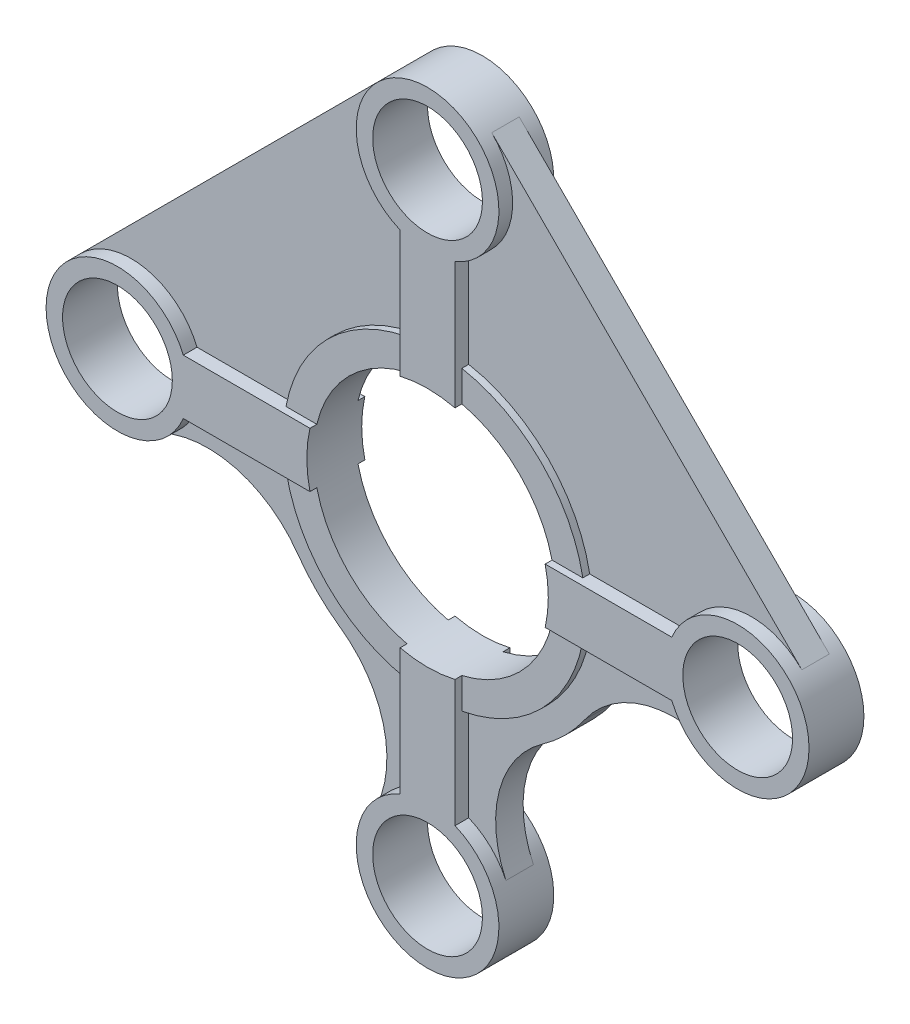
from build123d import *

# Parameters (mm, degrees)
SKETCH1_R             = 20
BOSS_EXTRUDE1_DEPTH   = 10
BOSS_EXTRUDE1_2_DEPTH = 10
BOSS_EXTRUDE1_3_DEPTH = 10
BOSS_EXTRUDE1_4_DEPTH = 10
BOSS_EXTRUDE2_DEPTH   = 7.5
BOSS_EXTRUDE3_DEPTH   = 5


with BuildPart() as part:
    # Sketch1 → Boss-Extrude1 (new, symmetric)
    with BuildSketch(Plane.XY):
        with BuildLine():
            ThreePointArc((-42.848570571, -10), (-44, 0), (-42.848570571, 10))
            Line((-42.848570571, 10), (-89, 10))
            ThreePointArc((-89, 10), (-139, 0), (-89, -10))
            Line((-89, -10), (-42.848570571, -10))
        make_face()
        with Locations((-113, 0)):
            Circle(SKETCH1_R, mode=Mode.SUBTRACT)
    extrude(amount=BOSS_EXTRUDE1_DEPTH, both=True)



with BuildPart() as body_2:
    # Sketch1 → Boss-Extrude1 2 (new, symmetric)
    with BuildSketch(Plane.XY):
        with BuildLine():
            ThreePointArc((-10, 42.848570571), (0, 44), (10, 42.848570571))
            Line((10, 42.848570571), (10, 89))
            ThreePointArc((10, 89), (0, 139), (-10, 89))
            Line((-10, 89), (-10, 42.848570571))
        make_face()
        with Locations((0, 113)):
            Circle(SKETCH1_R, mode=Mode.SUBTRACT)
    extrude(amount=BOSS_EXTRUDE1_2_DEPTH, both=True)


with BuildPart() as body_3:
    # Sketch1 → Boss-Extrude1 3 (new, symmetric)
    with BuildSketch(Plane.XY):
        with BuildLine():
            ThreePointArc((10, -42.848570571), (0, -44), (-10, -42.848570571))
            Line((-10, -42.848570571), (-10, -89))
            ThreePointArc((-10, -89), (0, -139), (10, -89))
            Line((10, -89), (10, -42.848570571))
        make_face()
        with Locations((0, -113)):
            Circle(SKETCH1_R, mode=Mode.SUBTRACT)
    extrude(amount=BOSS_EXTRUDE1_3_DEPTH, both=True)


with BuildPart() as body_4:
    # Sketch1 → Boss-Extrude1 4 (new, symmetric)
    with BuildSketch(Plane.XY):
        with BuildLine():
            ThreePointArc((42.848570571, 10), (44, 0), (42.848570571, -10))
            Line((42.848570571, -10), (89, -10))
            ThreePointArc((89, -10), (139, 0), (89, 10))
            Line((89, 10), (42.848570571, 10))
        make_face()
        with Locations((113, 0)):
            Circle(SKETCH1_R, mode=Mode.SUBTRACT)
    extrude(amount=BOSS_EXTRUDE1_4_DEPTH, both=True)


with BuildPart() as part_1:
    add(part.part)

    add(body_2.part)  # Boss-Extrude2 merges body 2

    add(body_3.part)  # Boss-Extrude2 merges body 3

    add(body_4.part)  # Boss-Extrude2 merges body 4
    # Sketch1<3> → Boss-Extrude2 (add, symmetric)
    with BuildSketch(Plane.XY):
        with BuildLine():
            Line((-54.083269132, 10), (-42.848570571, 10))
            ThreePointArc((-42.848570571, 10), (-31.112698372, 31.112698372), (-10, 42.848570571))
            Line((-10, 42.848570571), (-10, 54.083269132))
            ThreePointArc((-10, 54.083269132), (-38.890872965, 38.890872965), (-54.083269132, 10))
        make_face()
        with BuildLine():
            ThreePointArc((-10, -42.848570571), (-31.112698372, -31.112698372), (-42.848570571, -10))
            Line((-42.848570571, -10), (-54.083269132, -10))
            ThreePointArc((-54.083269132, -10), (-38.890872965, -38.890872965), (-10, -54.083269132))
            Line((-10, -54.083269132), (-10, -42.848570571))
        make_face()
        with BuildLine():
            Line((10, 54.083269132), (10, 42.848570571))
            ThreePointArc((10, 42.848570571), (31.112698372, 31.112698372), (42.848570571, 10))
            Line((42.848570571, 10), (54.083269132, 10))
            ThreePointArc((54.083269132, 10), (38.890872965, 38.890872965), (10, 54.083269132))
        make_face()
        with BuildLine():
            ThreePointArc((42.848570571, -10), (31.112698372, -31.112698372), (10, -42.848570571))
            Line((10, -42.848570571), (10, -54.083269132))
            ThreePointArc((10, -54.083269132), (38.890872965, -38.890872965), (54.083269132, -10))
            Line((54.083269132, -10), (42.848570571, -10))
        make_face()
    extrude(amount=BOSS_EXTRUDE2_DEPTH, both=True)

    # Sketch1<4> → Boss-Extrude3 (add, symmetric)
    with BuildSketch(Plane.XY):
        with BuildLine():
            Line((-89, 10), (-54.083269132, 10))
            ThreePointArc((-54.083269132, 10), (-38.890872965, 38.890872965), (-10, 54.083269132))
            Line((-10, 54.083269132), (-10, 89))
            ThreePointArc((-10, 89), (-25.505709112, 107.954328319), (-18.384776311, 131.384776311))
            Line((-18.384776311, 131.384776311), (-131.384776311, 18.384776311))
            ThreePointArc((-131.384776311, 18.384776311), (-107.954328319, 25.505709112), (-89, 10))
        make_face()
        with BuildLine():
            ThreePointArc((-10, -54.083269132), (-38.890872965, -38.890872965), (-54.083269132, -10))
            Line((-54.083269132, -10), (-89, -10))
            ThreePointArc((-89, -10), (-94.233874983, -17.995348061), (-102.002815768, -23.559752524))
            ThreePointArc((-102.002815768, -23.559752524), (-74.773631801, -21.15717706), (-52.359428182, -36.803400392))
            ThreePointArc((-52.359428182, -36.803400392), (-45.254833996, -45.254833996), (-36.803400392, -52.359428182))
            ThreePointArc((-36.803400392, -52.359428182), (-21.15717706, -74.773631801), (-23.559752524, -102.002815768))
            ThreePointArc((-23.559752524, -102.002815768), (-17.995348061, -94.233874983), (-10, -89))
            Line((-10, -89), (-10, -54.083269132))
        make_face()
        with BuildLine():
            Line((10, 89), (10, 54.083269132))
            ThreePointArc((10, 54.083269132), (38.890872965, 38.890872965), (54.083269132, 10))
            Line((54.083269132, 10), (89, 10))
            ThreePointArc((89, 10), (107.954328319, 25.505709112), (131.384776311, 18.384776311))
            Line((131.384776311, 18.384776311), (18.384776311, 131.384776311))
            ThreePointArc((18.384776311, 131.384776311), (25.505709112, 107.954328319), (10, 89))
        make_face()
        with BuildLine():
            ThreePointArc((54.083269132, -10), (38.890872965, -38.890872965), (10, -54.083269132))
            Line((10, -54.083269132), (10, -89))
            ThreePointArc((10, -89), (17.995348061, -94.233874983), (23.559752524, -102.002815768))
            ThreePointArc((23.559752524, -102.002815768), (21.15717706, -74.773631801), (36.803400392, -52.359428182))
            ThreePointArc((36.803400392, -52.359428182), (45.254833996, -45.254833996), (52.359428182, -36.803400392))
            ThreePointArc((52.359428182, -36.803400392), (74.773631801, -21.15717706), (102.002815768, -23.559752524))
            ThreePointArc((102.002815768, -23.559752524), (94.233874983, -17.995348061), (89, -10))
            Line((89, -10), (54.083269132, -10))
        make_face()
    extrude(amount=BOSS_EXTRUDE3_DEPTH, both=True)


solid = part_1.part
